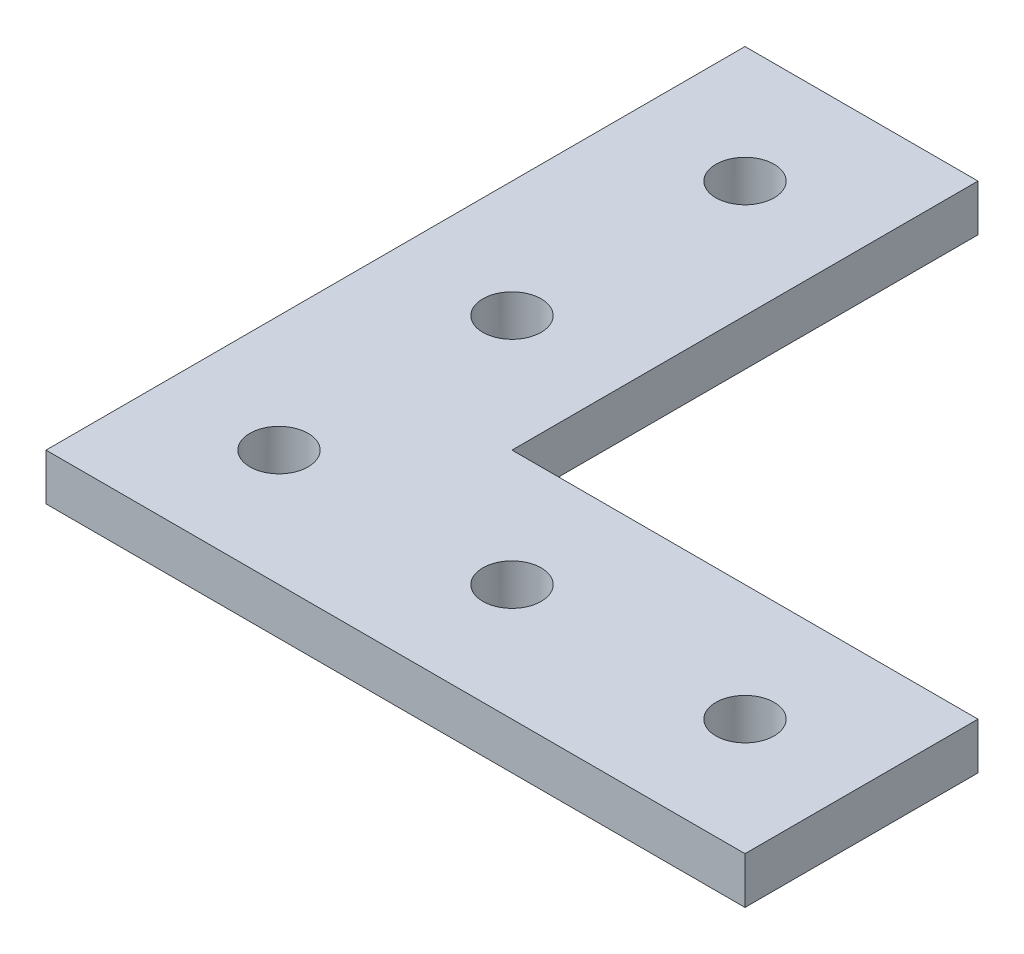
from build123d import *

# Parameters (mm, degrees)
BOSS_EXTRUDE1_DEPTH             = 5.08
F_1_4_0_25_DIAMETER_HOLE1_D     = 6.35
F_1_4_0_25_DIAMETER_HOLE1_DEPTH = 25.4
F_1_4_0_25_DIAMETER_HOLE1_TIP   = 1.907732465


with BuildPart() as part:
    # Sketch1 → Boss-Extrude1 (new body)
    with BuildSketch(Plane(origin=(0, 0, 0), x_dir=(1, 0, 0), z_dir=(0, 1, 0))):
        Polygon((0, 0), (0, 76.2), (25.4, 76.2), (25.4, 25.4), (76.2, 25.4), (76.2, 0), align=None)
    extrude(amount=BOSS_EXTRUDE1_DEPTH)

    # 1/4 (0.25) Diameter Hole1
    with Locations(Plane(origin=(0, 5.08, 0), x_dir=(1, 0, 0), z_dir=(0, 1, 0))):
        with Locations((12.7, 63.5), (12.7, 38.1), (12.7, 12.7), (38.1, 12.7), (63.5, 12.7)):
            Hole(F_1_4_0_25_DIAMETER_HOLE1_D / 2, depth=F_1_4_0_25_DIAMETER_HOLE1_DEPTH)
            with Locations((0, 0, -(F_1_4_0_25_DIAMETER_HOLE1_DEPTH + F_1_4_0_25_DIAMETER_HOLE1_TIP / 2))):  # 118° drill point
                Cone(0, F_1_4_0_25_DIAMETER_HOLE1_D / 2, F_1_4_0_25_DIAMETER_HOLE1_TIP, mode=Mode.SUBTRACT)


solid = part.part
